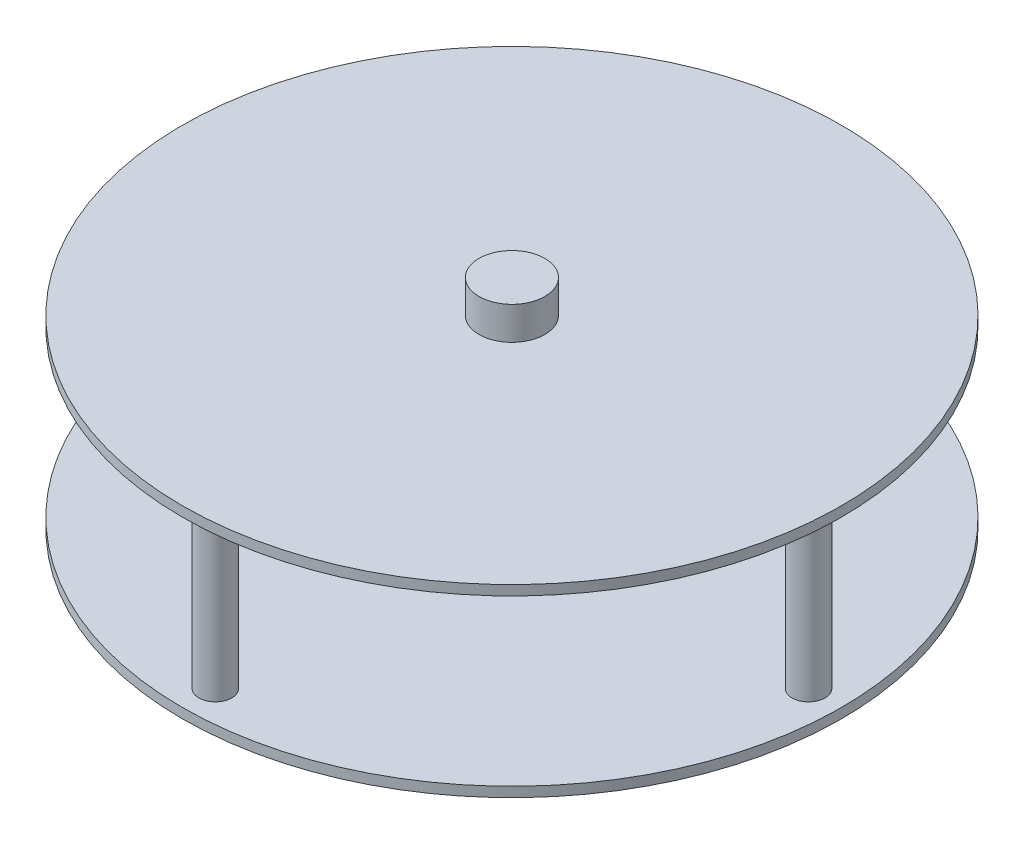
from build123d import *

# Parameters (mm, degrees)
SKETCH1_R           = 100
BOSS_EXTRUDE1_DEPTH = 3
SKETCH2_R           = 5
BOSS_EXTRUDE2_DEPTH = 50
SKETCH3_R           = 10
BOSS_EXTRUDE3_DEPTH = 10


with BuildPart() as part:
    # Sketch1 → Boss-Extrude1 (new body)
    with BuildSketch(Plane(origin=(0, 0, 0), x_dir=(1, 0, 0), z_dir=(0, 1, 0))):
        with Locations(Location((0, 0, 0), (0, 0, 270))):
            Circle(SKETCH1_R)
    boss_extrude1 = extrude(amount=BOSS_EXTRUDE1_DEPTH)

    # Sketch2 → Boss-Extrude2 (add)
    with BuildSketch(Plane(origin=(0, 3, 0), x_dir=(1, 0, 0), z_dir=(0, 1, 0))):
        with Locations(Location((-90, 0, 0), (0, 0, 270))):
            Circle(SKETCH2_R)
        with Locations(Location((0, 90, 0), (0, 0, 270))):
            Circle(SKETCH2_R)
        with Locations(Location((90, 0, 0), (0, 0, 270))):
            Circle(SKETCH2_R)
        with Locations(Location((0, -90, 0), (0, 0, 270))):
            Circle(SKETCH2_R)
    extrude(amount=BOSS_EXTRUDE2_DEPTH)

    # Mirror1: Boss-Extrude1 across plane
    add(boss_extrude1.mirror(Plane.ZX.offset(28)))

    # Sketch3 → Boss-Extrude3 (add)
    with BuildSketch(Plane(origin=(0, 56, 0), x_dir=(1, 0, 0), z_dir=(0, 1, 0))):
        with Locations(Location((0, 0, 0), (0, 0, 90))):
            Circle(SKETCH3_R)
    extrude(amount=BOSS_EXTRUDE3_DEPTH)


solid = part.part
